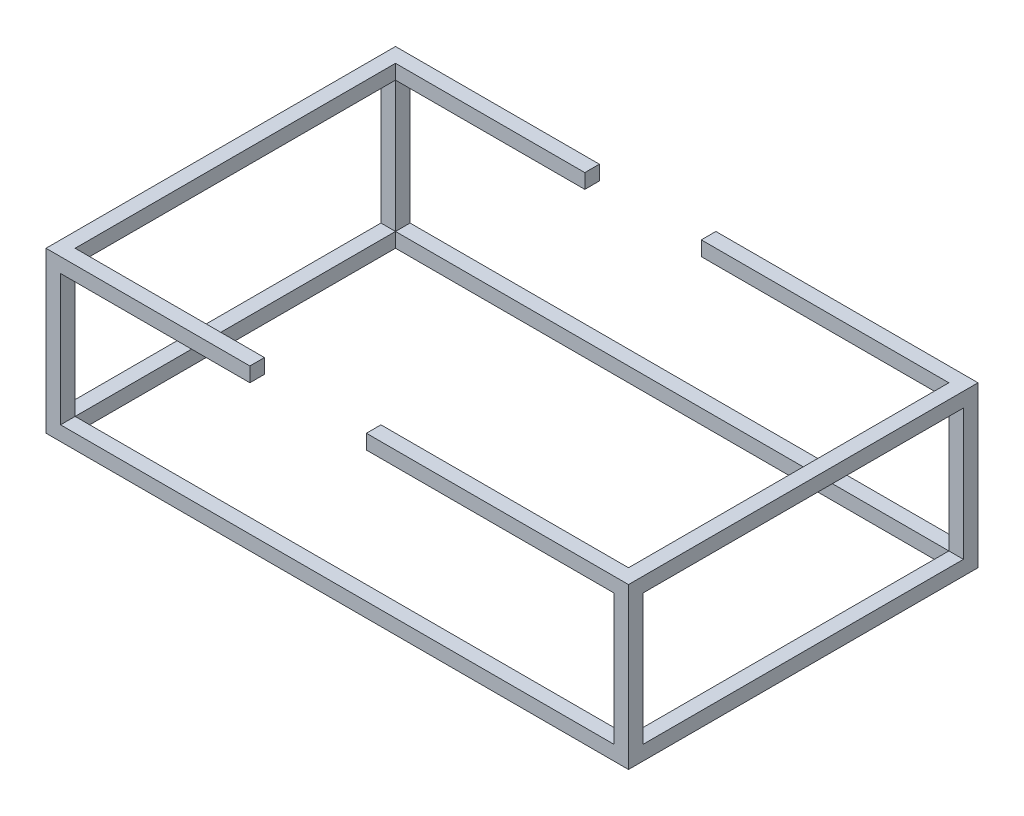
from build123d import *

# Parameters (mm, degrees)
SKETCH3_W                = 1016
SKETCH3_H                = 609.6
SKETCH3_W_2              = 965.2
SKETCH3_H_2              = 558.8
BOSS_EXTRUDE1_DEPTH      = 25.4
SKETCH4_W                = 25.4
SKETCH4_H                = 25.4
BOSS_EXTRUDE2_DEPTH      = 228.6
BOSS_EXTRUDE3_DEPTH      = 330.2
BOSS_EXTRUDE3_DEPTH_BACK = 25.4
SKETCH6_W                = 25.4
SKETCH6_H                = 25.4
BOSS_EXTRUDE4_DEPTH      = 431.8
BOSS_EXTRUDE4_DEPTH_BACK = 25.4
SKETCH7_W                = 25.4
SKETCH7_H                = 25.4
SKETCH8_W                = 25.4
SKETCH8_H                = 25.4
BOSS_EXTRUDE5_DEPTH      = 558.8


with BuildPart() as part:
    # Sketch3 → Boss-Extrude1 (new body)
    with BuildSketch(Plane(origin=(0, 0, 0), x_dir=(1, 0, 0), z_dir=(0, 1, 0))):
        Rectangle(SKETCH3_W, SKETCH3_H)
        Rectangle(SKETCH3_W_2, SKETCH3_H_2, mode=Mode.SUBTRACT)
    extrude(amount=BOSS_EXTRUDE1_DEPTH)

    # Sketch4 → Boss-Extrude2 (add)
    with BuildSketch(Plane(origin=(0, 25.4, 0), x_dir=(1, 0, 0), z_dir=(0, 1, 0))):
        with Locations((-495.3, 292.1)):
            Rectangle(SKETCH4_W, SKETCH4_H)
        with Locations((495.3, 292.1)):
            Rectangle(SKETCH4_W, SKETCH4_H)
        with Locations((495.3, -292.1)):
            Rectangle(SKETCH4_W, SKETCH4_H)
        with Locations((-495.3, -292.1)):
            Rectangle(SKETCH4_W, SKETCH4_H)
    extrude(amount=BOSS_EXTRUDE2_DEPTH)

    # Sketch6 → Boss-Extrude3 (add, two sides: drawn at the far end of the back side and taken through both)
    with BuildSketch(Plane(origin=(-482.6, 0, 0), x_dir=(0, 0, -1), z_dir=(1, 0, 0)).offset(-BOSS_EXTRUDE3_DEPTH_BACK)):
        with Locations((-292.1, 266.7)):
            Rectangle(SKETCH6_W, SKETCH6_H)
        with Locations((292.1, 266.7)):
            Rectangle(SKETCH6_W, SKETCH6_H)
    extrude(amount=BOSS_EXTRUDE3_DEPTH + BOSS_EXTRUDE3_DEPTH_BACK)

    # Sketch7 → Boss-Extrude4 (add, two sides: drawn at the far end of the back side and taken through both)
    with BuildSketch(Plane.ZY.offset(-482.6).offset(-BOSS_EXTRUDE4_DEPTH_BACK)):
        with Locations((292.1, 266.7)):
            Rectangle(SKETCH7_W, SKETCH7_H)
        with Locations((-292.1, 266.7)):
            Rectangle(SKETCH7_W, SKETCH7_H)
    extrude(amount=BOSS_EXTRUDE4_DEPTH + BOSS_EXTRUDE4_DEPTH_BACK)

    # Sketch8 → Boss-Extrude5 (add)
    with BuildSketch(Plane.XY.offset(-279.4)):
        with Locations((495.3, 266.7)):
            Rectangle(SKETCH8_W, SKETCH8_H)
        with Locations((-495.3, 266.7)):
            Rectangle(SKETCH8_W, SKETCH8_H)
    extrude(amount=BOSS_EXTRUDE5_DEPTH)


solid = part.part
